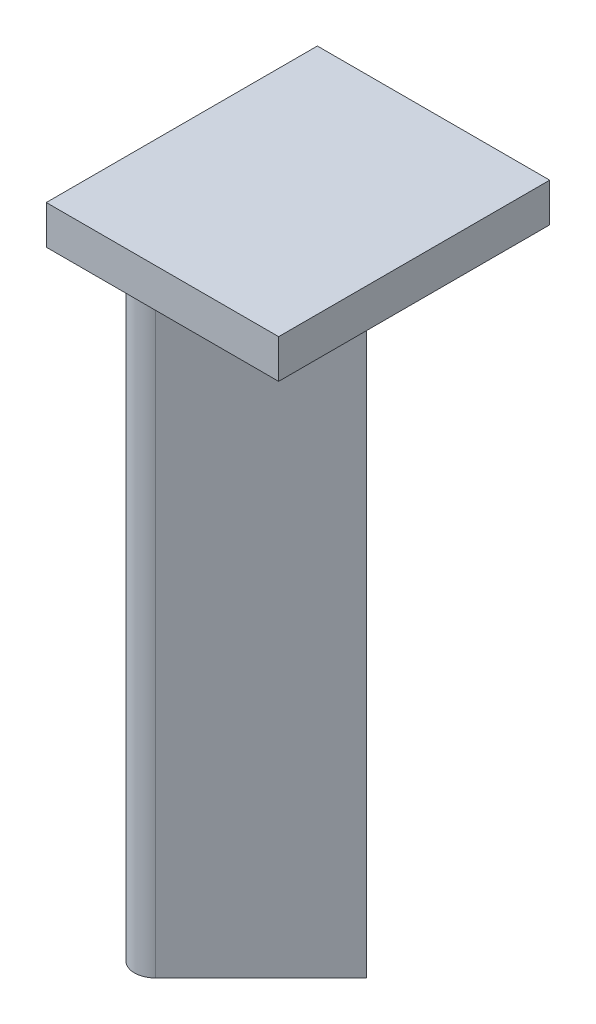
from build123d import *

# Parameters (mm, degrees)
BOSS_EXTRUDE1_DEPTH = 78
SKETCH2_W           = 30
SKETCH2_H           = 35
BOSS_EXTRUDE2_DEPTH = 5


with BuildPart() as part:
    # Sketch1 → Boss-Extrude1 (new body)
    with BuildSketch(Plane(origin=(0, 0, 0), x_dir=(1, 0, 0), z_dir=(0, 1, 0))):
        with BuildLine():
            Line((-0.706968119, 0.735252391), (-9.814642123, 9.842926394))
            ThreePointArc((-9.814642123, 9.842926394), (-9.814642123, 13.633018741), (-6.024549776, 13.633018741))
            Line((-6.024549776, 13.633018741), (7.608468966, 0))
            Line((7.608468966, 0), (-6.024549776, -13.633018741))
            ThreePointArc((-6.024549776, -13.633018741), (-9.814642123, -13.633018741), (-9.814642123, -9.842926394))
            Line((-9.814642123, -9.842926394), (-0.706968119, -0.735252391))
            ThreePointArc((-0.706968119, -0.735252391), (1.02, 0), (-0.706968119, 0.735252391))
        make_face()
    extrude(amount=BOSS_EXTRUDE1_DEPTH)

    # Sketch2 → Boss-Extrude2 (add)
    with BuildSketch(Plane(origin=(0, 78, 0), x_dir=(1, 0, 0), z_dir=(0, 1, 0))):
        with Locations((-1.777418097, 0.544410307)):
            Rectangle(SKETCH2_W, SKETCH2_H)
    extrude(amount=BOSS_EXTRUDE2_DEPTH)


solid = part.part
